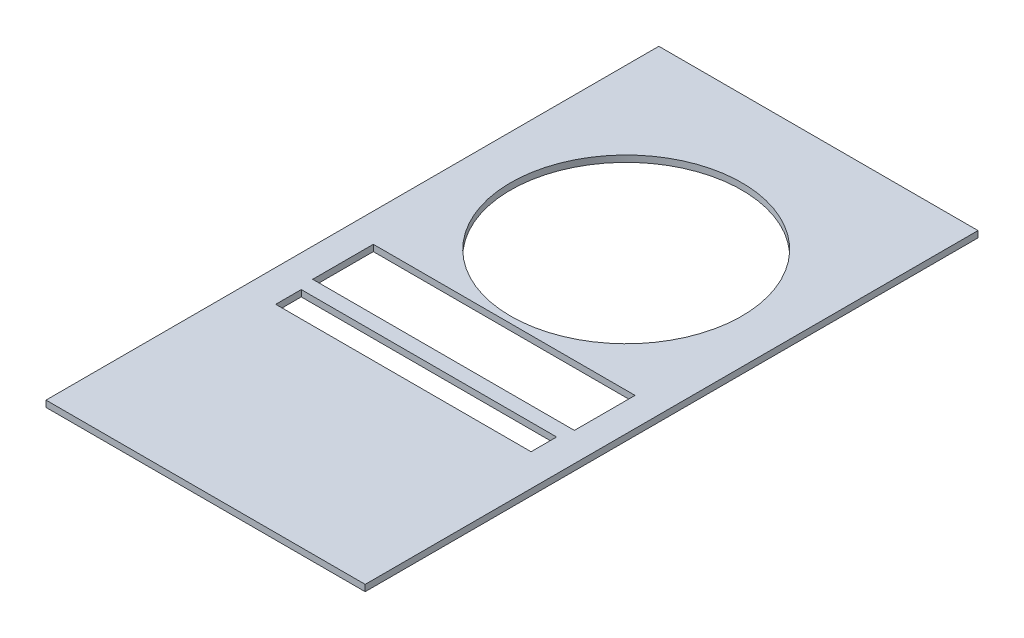
from build123d import *

# Parameters (mm, degrees)
SKETCH1_W           = 158.75
SKETCH1_H           = 304.8
SKETCH1_R           = 57.5
SKETCH1_W_2         = 130.175
SKETCH1_H_2         = 30.1625
SKETCH1_W_3         = 127
SKETCH1_H_3         = 12.7
BOSS_EXTRUDE1_DEPTH = 3.175


with BuildPart() as part:
    # Sketch1 → Boss-Extrude1 (new body)
    with BuildSketch(Plane(origin=(0, 0, 0), x_dir=(1, 0, 0), z_dir=(0, 1, 0))):
        with Locations((79.375, 152.4)):
            Rectangle(SKETCH1_W, SKETCH1_H)
        with Locations(Location((79.375, 209.2, 0), (0, 0, 270))):
            Circle(SKETCH1_R, mode=Mode.SUBTRACT)
        with Locations((79.375, 133.432370025)):
            Rectangle(SKETCH1_W_2, SKETCH1_H_2, mode=Mode.SUBTRACT)
        with Locations((79.375, 104.734192112)):
            Rectangle(SKETCH1_W_3, SKETCH1_H_3, mode=Mode.SUBTRACT)
    extrude(amount=BOSS_EXTRUDE1_DEPTH)


solid = part.part
